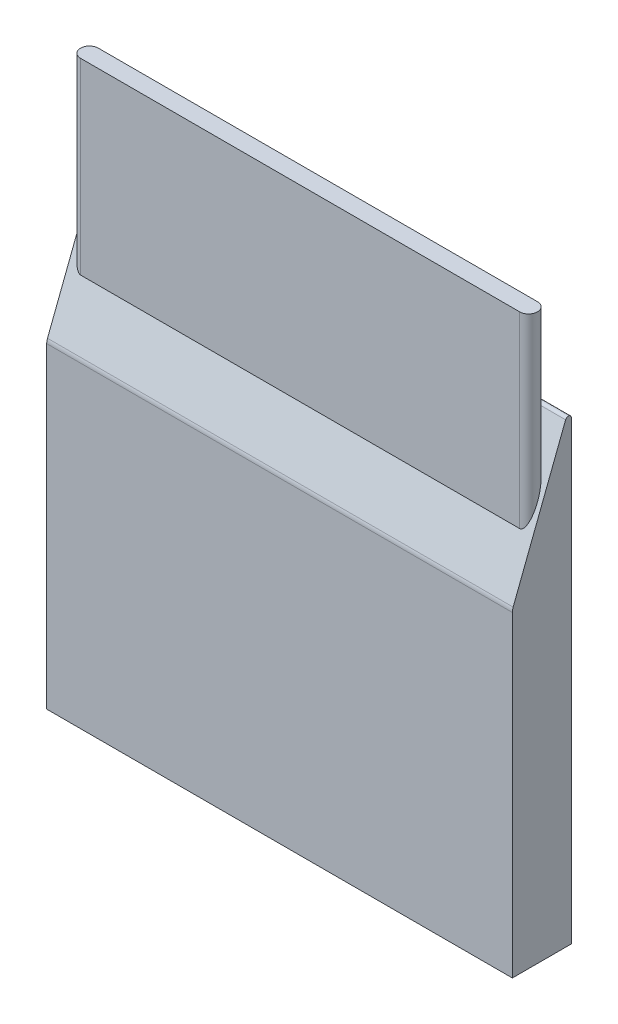
from build123d import *

# Parameters (mm, degrees)
CROQUIS1_W                   = 79
CROQUIS1_H                   = 80
SALIENTE_EXTRUIR1_DEPTH      = 10
CORTAR_EXTRUIR2_DEPTH        = 80
REDONDEO3_R                  = 0.5
REDONDEO4_R                  = 2
SALIENTE_EXTRUIR2_DEPTH      = 15
SALIENTE_EXTRUIR2_DEPTH_BACK = 20


with BuildPart() as part:
    # Croquis1 → Saliente-Extruir1 (new body)
    with BuildSketch(Plane.XY):
        with Locations((27.815761317, -20.14086116)):
            Rectangle(CROQUIS1_W, CROQUIS1_H)
    extrude(amount=SALIENTE_EXTRUIR1_DEPTH)

    # Croquis3 → Cortar-Extruir2 (cut)
    with BuildSketch(Plane(origin=(67.315761317, 0, 0), x_dir=(0, 0, -1), z_dir=(1, 0, 0))):
        Polygon((-10, 19.85913884), (-10, -6.06086116), (0, 19.85913884), align=None)
    extrude(amount=-CORTAR_EXTRUIR2_DEPTH, mode=Mode.SUBTRACT)

    # Redondeo3
    redondeo3_edges = [part.edges().sort_by_distance(p)[0] for p in [
        (27.815761317, 19.85913884, 0),
    ]]
    fillet(redondeo3_edges, radius=REDONDEO3_R)

    # Redondeo4
    redondeo4_edges = [part.edges().sort_by_distance(p)[0] for p in [
        (27.815761317, -6.06086116, 10),
    ]]
    fillet(redondeo4_edges, radius=REDONDEO4_R)


with BuildPart() as body_2:
    # Croquis2 → Saliente-Extruir2 (new, two sides: drawn at the far end of the back side and taken through both)
    with BuildSketch(Plane(origin=(0, 19.85913884, 0), x_dir=(1, 0, 0), z_dir=(0, 1, 0)).offset(-SALIENTE_EXTRUIR2_DEPTH_BACK)):
        with BuildLine():
            Line((65.065761317, -6.5), (-9.434238683, -6.5))
            ThreePointArc((-9.434238683, -6.5), (-10.934238683, -5), (-9.434238683, -3.5))
            Line((-9.434238683, -3.5), (65.065761317, -3.5))
            ThreePointArc((65.065761317, -3.5), (66.565761317, -5), (65.065761317, -6.5))
        make_face()
    extrude(amount=SALIENTE_EXTRUIR2_DEPTH + SALIENTE_EXTRUIR2_DEPTH_BACK)


solid = Compound([part.part, body_2.part])
